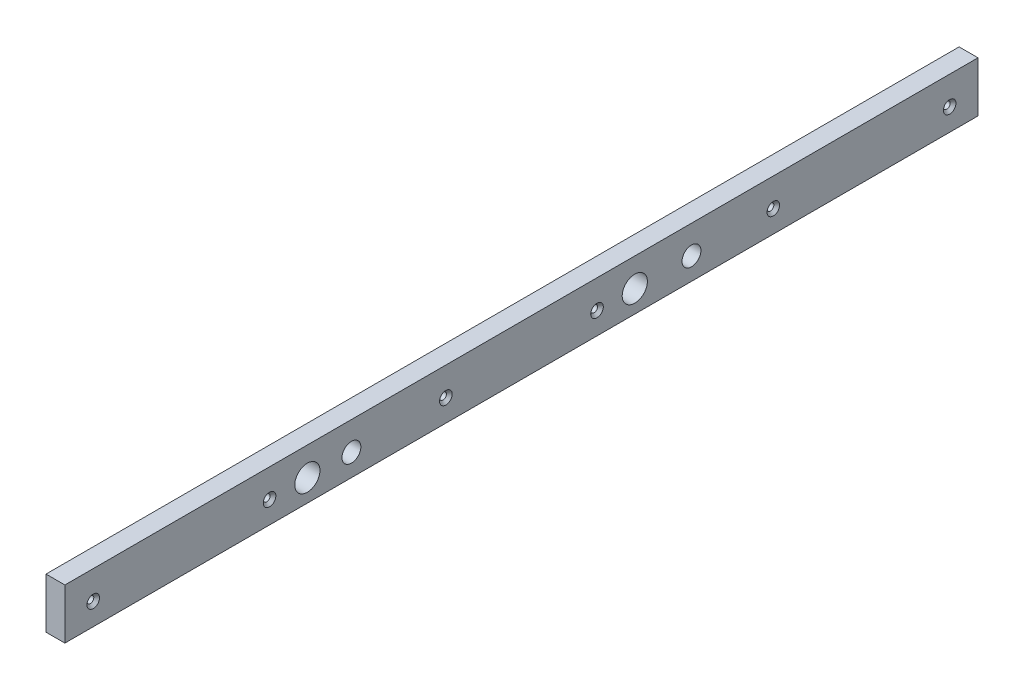
from build123d import *

# Parameters (mm, degrees)
SKETCH1_W                      = 9.525
SKETCH1_H                      = 25.4
BOSS_EXTRUDE1_DEPTH            = 230.1875
CUT_EXTRUDE1_REACH             = 232.734
SKETCH2_R                      = 6.35
F_3_8_0_375_DIAMETER_HOLE1_D   = 9.525
F_8_32_TAPPED_HOLE1_AT_2_COUNT = 2
F_8_32_TAPPED_HOLE1_AT_2_PITCH = 177.8
F_8_32_TAPPED_HOLE1_AT_3_COUNT = 2
F_8_32_TAPPED_HOLE1_AT_3_PITCH = 254
F_8_32_TAPPED_HOLE1_AT_4_COUNT = 2
F_8_32_TAPPED_HOLE1_AT_4_PITCH = 431.8
F_8_32_TAPPED_HOLE1_AT_5_COUNT = 2
F_8_32_TAPPED_HOLE1_AT_5_PITCH = 342.9
F_8_32_TAPPED_HOLE1_AT_6_COUNT = 2
F_8_32_TAPPED_HOLE1_AT_6_PITCH = 88.9


with BuildPart() as part:
    # Sketch1 → Boss-Extrude1 (new, symmetric)
    with BuildSketch(Plane.XY):
        Rectangle(SKETCH1_W, SKETCH1_H)
    extrude(amount=BOSS_EXTRUDE1_DEPTH, both=True)

    # Sketch2 → Cut-Extrude1 (cut, up to next)
    with BuildSketch(Plane(origin=(4.7625, 0, 0), x_dir=(0, 0, -1), z_dir=(1, 0, 0)), mode=Mode.PRIVATE) as cut_extrude1_sk1:
        with Locations(Location((-107.95, -1.5875, 0), (0, 0, 90))):
            Circle(SKETCH2_R)
    cut_extrude1_tool1 = extrude(cut_extrude1_sk1.sketch, amount=-CUT_EXTRUDE1_REACH, mode=Mode.PRIVATE) & part.part
    # Sketch2 → Cut-Extrude1 (cut, up to next)
    with BuildSketch(Plane(origin=(4.7625, 0, 0), x_dir=(0, 0, -1), z_dir=(1, 0, 0)), mode=Mode.PRIVATE) as cut_extrude1_sk2:
        with Locations(Location((57.15, -1.5875, 0), (0, 0, 90))):
            Circle(SKETCH2_R)
    cut_extrude1_tool2 = extrude(cut_extrude1_sk2.sketch, amount=-CUT_EXTRUDE1_REACH, mode=Mode.PRIVATE) & part.part
    add(cut_extrude1_tool1.solids().sort_by_distance((4.7625, -1.5875, 107.95))[0], mode=Mode.SUBTRACT)
    add(cut_extrude1_tool2.solids().sort_by_distance((4.7625, -1.5875, -57.15))[0], mode=Mode.SUBTRACT)

    # 3/8 (0.375) Diameter Hole1 (through all)
    with Locations(Plane.ZY.offset(4.7625)):
        with Locations((85.725, -1.5875), (-85.725, -1.5875)):
            Hole(F_3_8_0_375_DIAMETER_HOLE1_D / 2)

    # Sketch5 → #8-32 Tapped Hole1 (revolve, cut)
    with BuildSketch(Plane(origin=(4.7625, -1.5875, -215.9), x_dir=(0, 0, -1), z_dir=(0, 1, 0))):
        Polygon((0, 0), (0, 9.525), (2.286, 9.525), (1.7272, 8.9662), (1.7272, 1.4478), (3.175, 0), align=None)
    f_8_32_tapped_hole1 = revolve(axis=Axis((11.1125, -1.5875, -215.9), (-1, 0, 0)), mode=Mode.SUBTRACT)

    # #8-32 Tapped Hole1 at 2: #8-32 Tapped Hole1 ×2
    with Locations(*[(0, 0, i * F_8_32_TAPPED_HOLE1_AT_2_PITCH) for i in range(1, F_8_32_TAPPED_HOLE1_AT_2_COUNT)]):
        add(f_8_32_tapped_hole1, mode=Mode.SUBTRACT)

    # #8-32 Tapped Hole1 at 3: #8-32 Tapped Hole1 ×2
    with Locations(*[(0, 0, i * F_8_32_TAPPED_HOLE1_AT_3_PITCH) for i in range(1, F_8_32_TAPPED_HOLE1_AT_3_COUNT)]):
        add(f_8_32_tapped_hole1, mode=Mode.SUBTRACT)

    # #8-32 Tapped Hole1 at 4: #8-32 Tapped Hole1 ×2
    with Locations(*[(0, 0, i * F_8_32_TAPPED_HOLE1_AT_4_PITCH) for i in range(1, F_8_32_TAPPED_HOLE1_AT_4_COUNT)]):
        add(f_8_32_tapped_hole1, mode=Mode.SUBTRACT)

    # #8-32 Tapped Hole1 at 5: #8-32 Tapped Hole1 ×2
    with Locations(*[(0, 0, i * F_8_32_TAPPED_HOLE1_AT_5_PITCH) for i in range(1, F_8_32_TAPPED_HOLE1_AT_5_COUNT)]):
        add(f_8_32_tapped_hole1, mode=Mode.SUBTRACT)

    # #8-32 Tapped Hole1 at 6: #8-32 Tapped Hole1 ×2
    with Locations(*[(0, 0, i * F_8_32_TAPPED_HOLE1_AT_6_PITCH) for i in range(1, F_8_32_TAPPED_HOLE1_AT_6_COUNT)]):
        add(f_8_32_tapped_hole1, mode=Mode.SUBTRACT)


solid = part.part
